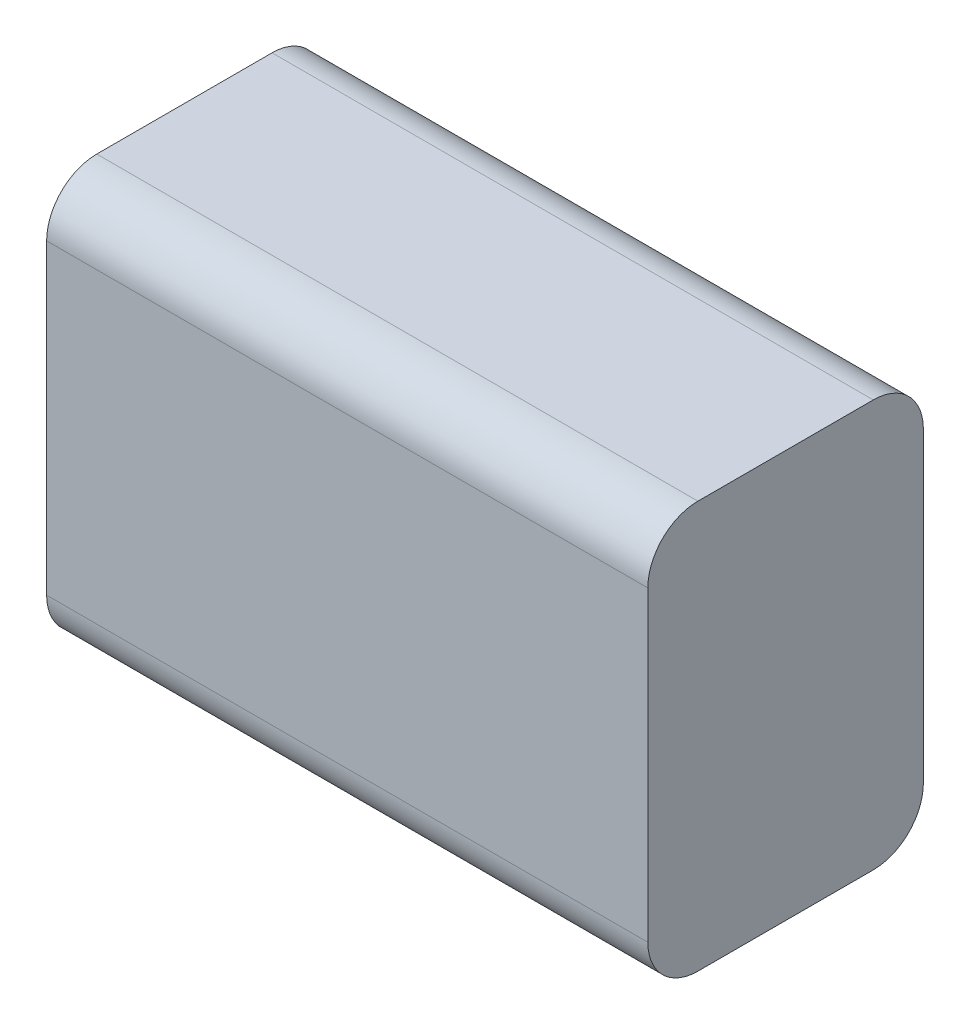
from build123d import *

# Parameters (mm, degrees)
SKETCH_1_W      = 48
SKETCH_1_H      = 32.5
EXTRUDE_1_DEPTH = 22
FILLET_1_R      = 4


with BuildPart() as part:
    # ｽｹｯﾁ1 → ﾎﾞｽ - 押し出し1 (new body)
    with BuildSketch(Plane.XY):
        Rectangle(SKETCH_1_W, SKETCH_1_H)
    extrude(amount=EXTRUDE_1_DEPTH)

    # ﾌｨﾚｯﾄ1
    fillet_1_edges = [part.edges().sort_by_distance(p)[0] for p in [
        (0, -16.25, 22),
        (0, -16.25, 0),
        (0, 16.25, 0),
        (0, 16.25, 22),
    ]]
    fillet(fillet_1_edges, radius=FILLET_1_R)


solid = part.part
